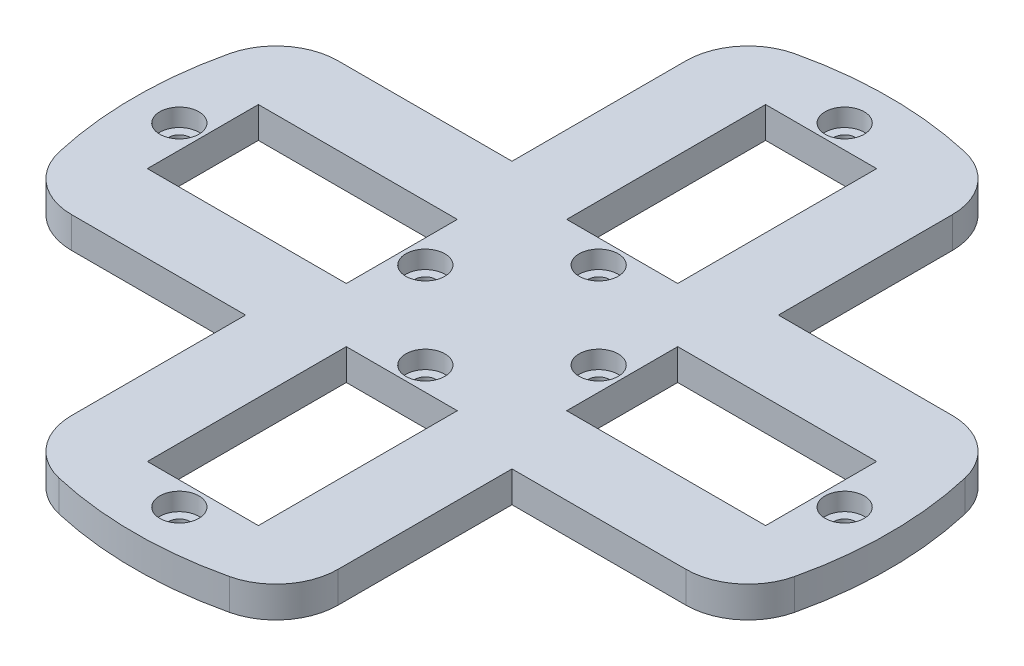
from build123d import *

# Parameters (mm, degrees)
SKETCH_1_R                   = 42.5
SKETCH_1_W                   = 12.5
SKETCH_1_H                   = 22.4
SKETCH_1_W_2                 = 22.4
SKETCH_1_H_2                 = 12.5
EXTRUDE_1_DEPTH              = 3.5
HOLE_WIZARD_M2_1_D           = 2.4
HOLE_WIZARD_M2_1_CBORE_D     = 4.4
HOLE_WIZARD_M2_1_CBORE_DEPTH = 2
SKETCH_5_W                   = 28.893914533
SKETCH_5_H                   = 29.378378832
SKETCH_5_W_2                 = 29.378378832
SKETCH_5_H_2                 = 28.893914533
CUT_EXTRUDE_1_DEPTH          = 10
FILLET_1_R                   = 7


with BuildPart() as part:
    # 草图1 → 凸台-拉伸1 (new body)
    with BuildSketch(Plane(origin=(0, 0, 0), x_dir=(1, 0, 0), z_dir=(0, 1, 0))):
        with Locations(Location((0, 0, 0), (0, 0, 270))):
            Circle(SKETCH_1_R)
        with Locations((0, 23.608701573)):
            Rectangle(SKETCH_1_W, SKETCH_1_H, mode=Mode.SUBTRACT)
        with Locations((-23.608701573, 0)):
            Rectangle(SKETCH_1_W_2, SKETCH_1_H_2, mode=Mode.SUBTRACT)
        with Locations((23.608701573, 0)):
            Rectangle(SKETCH_1_W_2, SKETCH_1_H_2, mode=Mode.SUBTRACT)
        with Locations((0, -23.608701573)):
            Rectangle(SKETCH_1_W, SKETCH_1_H, mode=Mode.SUBTRACT)
    extrude(amount=EXTRUDE_1_DEPTH)

    # M2 凹头盖螺钉的柱形沉头孔1 (through all)
    with Locations(Plane(origin=(-9.758701573, 3.5, 0), x_dir=(0, 0, 1), z_dir=(0, 1, 0))):
        with Locations((0, 0), (-9.758701573, 9.758701573), (0, 19.517403146), (9.758701573, 9.758701573), (0, 47.217403146), (-37.458701573, 9.758701573), (0, -27.7), (37.458701573, 9.758701573)):
            CounterBoreHole(HOLE_WIZARD_M2_1_D / 2, HOLE_WIZARD_M2_1_CBORE_D / 2, HOLE_WIZARD_M2_1_CBORE_DEPTH)

    # 草图5 → 切除-拉伸1 (cut)
    with BuildSketch(Plane(origin=(0, 3.5, 0), x_dir=(1, 0, 0), z_dir=(0, 1, 0))):
        with Locations((29.446957267, 29.689189416)):
            Rectangle(SKETCH_5_W, SKETCH_5_H)
        with Locations((-29.689189416, 29.446957267)):
            Rectangle(SKETCH_5_W_2, SKETCH_5_H_2)
        with Locations((29.689189416, -29.446957267)):
            Rectangle(SKETCH_5_W_2, SKETCH_5_H_2)
        with Locations((-29.446957267, -29.689189416)):
            Rectangle(SKETCH_5_W, SKETCH_5_H)
    extrude(amount=-CUT_EXTRUDE_1_DEPTH, mode=Mode.SUBTRACT)

    # 圆角1
    fillet_1_edges = [part.edges().sort_by_distance(p)[0] for p in [
        (-39.764934301, 1.75, -15),
        (-15, 1.75, -39.764934301),
        (-39.764934301, 1.75, 15),
        (-15, 1.75, 39.764934301),
        (15, 1.75, 39.764934301),
        (39.764934301, 1.75, 15),
        (39.764934301, 1.75, -15),
        (15, 1.75, -39.764934301),
    ]]
    fillet(fillet_1_edges, radius=FILLET_1_R)


solid = part.part
